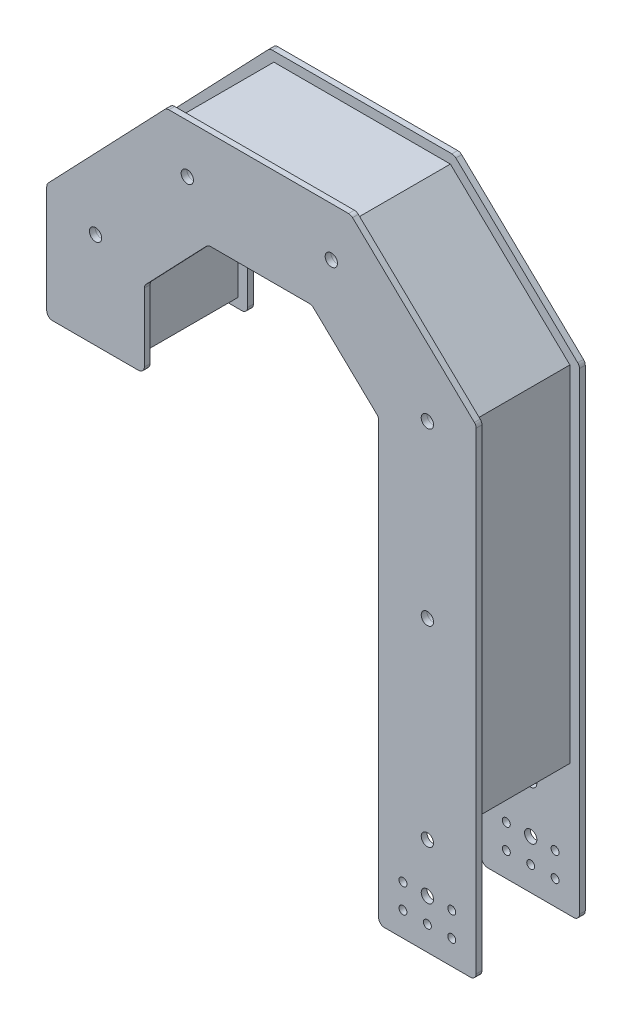
from build123d import *

# Parameters (mm, degrees)
SKETCH1_R           = 3.2
SKETCH1_R_2         = 2.07
BOSS_EXTRUDE1_DEPTH = 1.5
SKETCH2_R           = 3.2
BOSS_EXTRUDE2_DEPTH = 50.8
BOSS_EXTRUDE4_START = 52.3
SKETCH1_3_R         = 3.2
SKETCH1_3_R_2       = 2.07
BOSS_EXTRUDE4_DEPTH = 3
FILLET1_R           = 3
FILLET2_R           = 3


with BuildPart() as part:
    # Sketch1 → Boss-Extrude1 (new, symmetric)
    with BuildSketch(Plane.XY):
        Polygon((25.4, 0), (25.4, 199.524643379), (-39.817060467, 261.830017499), (-135.86232169, 261.830017499), (-198.167695809, 196.612957032), (-198.167695809, 136.430017499), (-147.367695809, 136.430017499), (-147.367695809, 176.247077966), (-114.13767831, 211.030017499), (-60.182939533, 211.030017499), (-25.4, 177.8), (-25.4, 0), (-25.4, -50.8), (25.4, -50.8), align=None)
        with Locations((-172.767695809, 186.430017499)):
            Circle(SKETCH1_R, mode=Mode.SUBTRACT)
        with Locations((-125, 236.430017499)):
            Circle(SKETCH1_R, mode=Mode.SUBTRACT)
        with Locations((-50, 236.430017499)):
            Circle(SKETCH1_R, mode=Mode.SUBTRACT)
        with Locations((0, 188.66232169)):
            Circle(SKETCH1_R, mode=Mode.SUBTRACT)
        Circle(SKETCH1_R, mode=Mode.SUBTRACT)
        with Locations((0, 99.76232169)):
            Circle(SKETCH1_R, mode=Mode.SUBTRACT)
        with Locations((0, -25.4)):
            Circle(SKETCH1_R, mode=Mode.SUBTRACT)
        with Locations((-12.7, -25.4)):
            Circle(SKETCH1_R_2, mode=Mode.SUBTRACT)
        with Locations(Location((12.7, -25.4, 0), (0, 0, 180))):
            Circle(SKETCH1_R_2, mode=Mode.SUBTRACT)
        with Locations((-12.7, -38.1)):
            Circle(SKETCH1_R_2, mode=Mode.SUBTRACT)
        with Locations(Location((12.7, -38.1, 0), (0, 0, 180))):
            Circle(SKETCH1_R_2, mode=Mode.SUBTRACT)
        with Locations((0, -38.1)):
            Circle(SKETCH1_R_2, mode=Mode.SUBTRACT)
    extrude(amount=BOSS_EXTRUDE1_DEPTH, both=True)

    # Fillet1
    fillet1_edges = [part.edges().sort_by_distance(p)[0] for p in [
        (25.4, -50.8, 0),
        (-25.4, -50.8, 0),
        (-25.4, 177.8, 0),
        (-60.182939533, 211.030017499, 0),
        (-114.13767831, 211.030017499, 0),
        (-147.367695809, 176.247077966, 0),
        (-147.367695809, 136.430017499, 0),
        (-198.167695809, 136.430017499, 0),
        (-198.167695809, 196.612957032, 0),
        (-135.86232169, 261.830017499, 0),
        (-39.817060467, 261.830017499, 0),
        (25.4, 199.524643379, 0),
    ]]
    fillet(fillet1_edges, radius=FILLET1_R)


with BuildPart() as body_2:
    # Sketch2 → Boss-Extrude2 (new body)
    with BuildSketch(Plane.XY.offset(1.5)):
        Polygon((-20.4, 179.938252301), (-20.4, 17.7), (20.4, 17.7), (20.4, 197.386391078), (-41.821576123, 256.830017499), (-133.724069389, 256.830017499), (-193.167695809, 194.608441375), (-193.167695809, 141.430017499), (-152.367695809, 141.430017499), (-152.367695809, 178.251593622), (-116.275930611, 216.030017499), (-58.178423877, 216.030017499), align=None)
        with Locations((0, 99.76232169)):
            Circle(SKETCH2_R, mode=Mode.SUBTRACT)
        with Locations((-172.767695809, 186.430017499)):
            Circle(SKETCH2_R, mode=Mode.SUBTRACT)
        with Locations((-125, 236.430017499)):
            Circle(SKETCH2_R, mode=Mode.SUBTRACT)
        with Locations((-50, 236.430017499)):
            Circle(SKETCH2_R, mode=Mode.SUBTRACT)
        with Locations((0, 188.66232169)):
            Circle(SKETCH2_R, mode=Mode.SUBTRACT)
    extrude(amount=BOSS_EXTRUDE2_DEPTH)


with BuildPart() as body_3:
    # Sketch1<3> → Boss-Extrude4 (new body)
    with BuildSketch(Plane.XY.offset(BOSS_EXTRUDE4_START)):
        Polygon((25.4, 0), (25.4, 199.524643379), (-39.817060467, 261.830017499), (-135.86232169, 261.830017499), (-198.167695809, 196.612957032), (-198.167695809, 136.430017499), (-147.367695809, 136.430017499), (-147.367695809, 176.247077966), (-114.13767831, 211.030017499), (-60.182939533, 211.030017499), (-25.4, 177.8), (-25.4, 0), (-25.4, -50.8), (25.4, -50.8), align=None)
        with Locations((-172.767695809, 186.430017499)):
            Circle(SKETCH1_3_R, mode=Mode.SUBTRACT)
        with Locations((-125, 236.430017499)):
            Circle(SKETCH1_3_R, mode=Mode.SUBTRACT)
        with Locations((-50, 236.430017499)):
            Circle(SKETCH1_3_R, mode=Mode.SUBTRACT)
        with Locations((0, 188.66232169)):
            Circle(SKETCH1_3_R, mode=Mode.SUBTRACT)
        Circle(SKETCH1_3_R, mode=Mode.SUBTRACT)
        with Locations((0, 99.76232169)):
            Circle(SKETCH1_3_R, mode=Mode.SUBTRACT)
        with Locations((0, -25.4)):
            Circle(SKETCH1_3_R, mode=Mode.SUBTRACT)
        with Locations((-12.7, -25.4)):
            Circle(SKETCH1_3_R_2, mode=Mode.SUBTRACT)
        with Locations((12.7, -25.4)):
            Circle(SKETCH1_3_R_2, mode=Mode.SUBTRACT)
        with Locations((-12.7, -38.1)):
            Circle(SKETCH1_3_R_2, mode=Mode.SUBTRACT)
        with Locations((12.7, -38.1)):
            Circle(SKETCH1_3_R_2, mode=Mode.SUBTRACT)
        with Locations((0, -38.1)):
            Circle(SKETCH1_3_R_2, mode=Mode.SUBTRACT)
    extrude(amount=BOSS_EXTRUDE4_DEPTH)

    # Fillet2
    fillet2_edges = [body_3.edges().sort_by_distance(p)[0] for p in [
        (-147.367695809, 136.430017499, 53.8),
        (-147.367695809, 176.247077966, 53.8),
        (-114.13767831, 211.030017499, 53.8),
        (-60.182939533, 211.030017499, 53.8),
        (-25.4, 177.8, 53.8),
        (-25.4, -50.8, 53.8),
        (25.4, -50.8, 53.8),
        (25.4, 199.524643379, 53.8),
        (-39.817060467, 261.830017499, 53.8),
        (-135.86232169, 261.830017499, 53.8),
        (-198.167695809, 196.612957032, 53.8),
        (-198.167695809, 136.430017499, 53.8),
    ]]
    fillet(fillet2_edges, radius=FILLET2_R)


solid = Compound([part.part, body_2.part, body_3.part])
